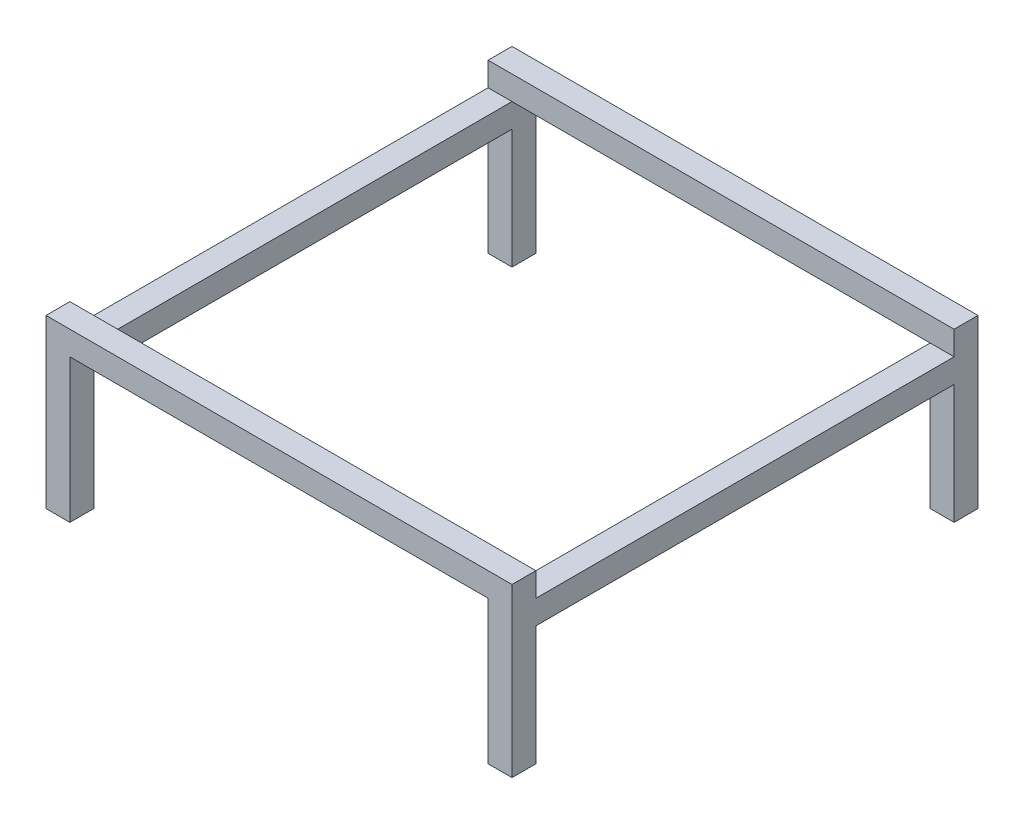
from build123d import *

# Parameters (mm, degrees)
SKETCH1_W               = 390
SKETCH1_H               = 390
SKETCH1_W_2             = 350
SKETCH1_H_2             = 350
BOSS_EXTRUDE1_DEPTH     = 20
SKETCH2_W               = 20
SKETCH2_H               = 20
BOSS_EXTRUDE2_DEPTH     = 100
SKETCH4_W               = 390
SKETCH4_H               = 20
BOSS_EXTRUDE3_DEPTH     = 20
CUT_EXTRUDE1_DEPTH      = 448.353327919
CUT_EXTRUDE1_DEPTH_BACK = 448.353327919
SKETCH5_W               = 350
SKETCH5_H               = 20


with BuildPart() as part:
    # Sketch1 → Boss-Extrude1 (new body)
    with BuildSketch(Plane(origin=(0, 0, 0), x_dir=(1, 0, 0), z_dir=(0, 1, 0))):
        Rectangle(SKETCH1_W, SKETCH1_H)
        Rectangle(SKETCH1_W_2, SKETCH1_H_2, mode=Mode.SUBTRACT)
    extrude(amount=BOSS_EXTRUDE1_DEPTH)

    # Sketch2 → Boss-Extrude2 (add)
    with BuildSketch(Plane.XZ):
        with Locations((-185, 185)):
            Rectangle(SKETCH2_W, SKETCH2_H)
        with Locations((185, 185)):
            Rectangle(SKETCH2_W, SKETCH2_H)
        with Locations((185, -185)):
            Rectangle(SKETCH2_W, SKETCH2_H)
        with Locations((-185, -185)):
            Rectangle(SKETCH2_W, SKETCH2_H)
    extrude(amount=BOSS_EXTRUDE2_DEPTH)

    # Sketch4 → Boss-Extrude3 (add)
    with BuildSketch(Plane(origin=(0, 20, 0), x_dir=(1, 0, 0), z_dir=(0, 1, 0))):
        with Locations((0, -185)):
            Rectangle(SKETCH4_W, SKETCH4_H)
        with Locations((0, 185)):
            Rectangle(SKETCH4_W, SKETCH4_H)
    extrude(amount=BOSS_EXTRUDE3_DEPTH)

    # Sketch5 → Cut-Extrude1 (cut, two sides: drawn at the far end of the back side and taken through both)
    with BuildSketch(Plane.XY.offset(195).offset(-CUT_EXTRUDE1_DEPTH_BACK)):
        with Locations((0, 10)):
            Rectangle(SKETCH5_W, SKETCH5_H)
    extrude(amount=CUT_EXTRUDE1_DEPTH + CUT_EXTRUDE1_DEPTH_BACK, mode=Mode.SUBTRACT)


solid = part.part
